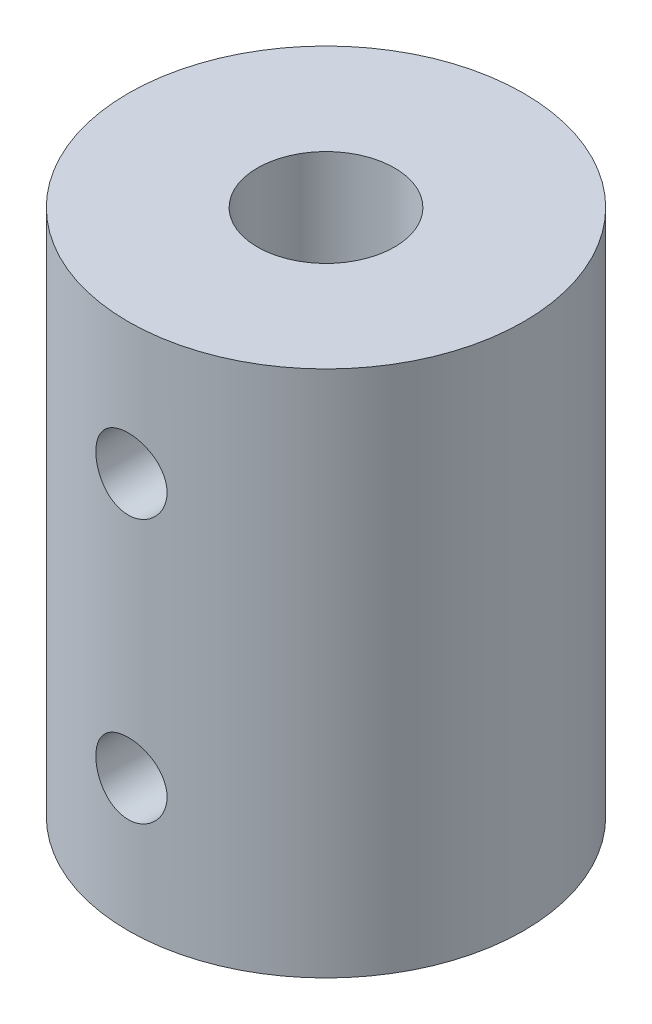
from build123d import *

# Parameters (mm, degrees)
SKETCH1_R                  = 7.5
BOSS_EXTRUDE1_DEPTH        = 10
CUT_EXTRUDE1_START         = -10
SKETCH2_R                  = 2.6
CUT_EXTRUDE1_DEPTH         = 10
CUT_EXTRUDE2_START         = -10
SKETCH3_R                  = 4.1
CUT_EXTRUDE2_DEPTH         = 10
F_2_7_2_7_DIAMETER_HOLE1_D = 2.7


with BuildPart() as part:
    # Sketch1 → Boss-Extrude1 (new, symmetric)
    with BuildSketch(Plane(origin=(0, 0, 0), x_dir=(1, 0, 0), z_dir=(0, 1, 0))):
        with Locations(Location((0, 0, 0), (0, 0, 270))):
            Circle(SKETCH1_R)
    extrude(amount=BOSS_EXTRUDE1_DEPTH, both=True)

    # Sketch2 → Cut-Extrude1 (cut)
    with BuildSketch(Plane(origin=(0, 10, 0), x_dir=(1, 0, 0), z_dir=(0, 1, 0)).offset(CUT_EXTRUDE1_START)):
        with Locations(Location((0, 0, 0), (0, 0, 270))):
            Circle(SKETCH2_R)
    extrude(amount=CUT_EXTRUDE1_DEPTH, mode=Mode.SUBTRACT)

    # Sketch3 → Cut-Extrude2 (cut)
    with BuildSketch(Plane.XZ.offset(10).offset(CUT_EXTRUDE2_START)):
        with Locations(Location((0, 0, 0), (0, 0, 270))):
            Circle(SKETCH3_R)
    extrude(amount=CUT_EXTRUDE2_DEPTH, mode=Mode.SUBTRACT)

    # Ø2.7 (2.7) Diameter Hole1 (through all)
    with Locations(Plane.XY.offset(10)):
        with Locations((0, 5), (0, -5)):
            Hole(F_2_7_2_7_DIAMETER_HOLE1_D / 2)


solid = part.part
